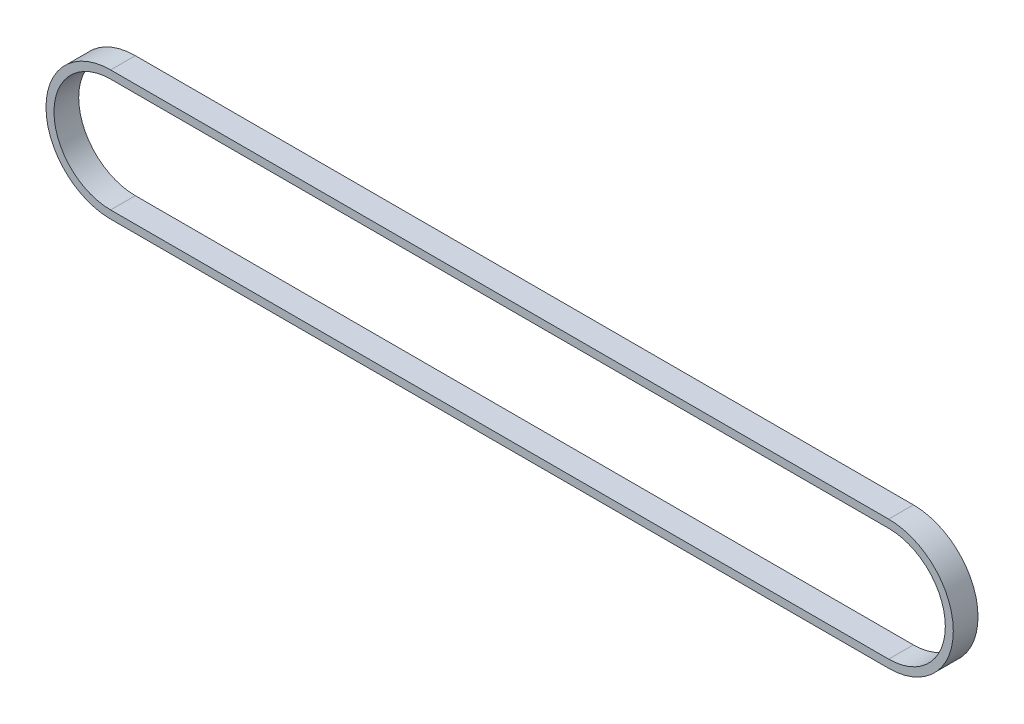
from build123d import *

# Parameters (mm, degrees)
EXTRUDE_1_DEPTH = 3


with BuildPart() as part:
    # ｽｹｯﾁ1 → ﾎﾞｽ - 押し出し1 (new, symmetric)
    with BuildSketch(Plane.XY):
        with BuildLine():
            Line((-89, 23.199), (100, 23.199))
            ThreePointArc((100, 23.199), (115.699, 7.5), (100, -8.199))
            Line((100, -8.199), (-89, -8.199))
            ThreePointArc((-89, -8.199), (-104.699, 7.5), (-89, 23.199))
        make_face()
        with BuildLine():
            Line((-89, 21.259), (100, 21.259))
            ThreePointArc((100, 21.259), (113.759, 7.5), (100, -6.259))
            Line((100, -6.259), (-89, -6.259))
            ThreePointArc((-89, -6.259), (-102.759, 7.5), (-89, 21.259))
        make_face(mode=Mode.SUBTRACT)
    extrude(amount=EXTRUDE_1_DEPTH, both=True)


solid = part.part
